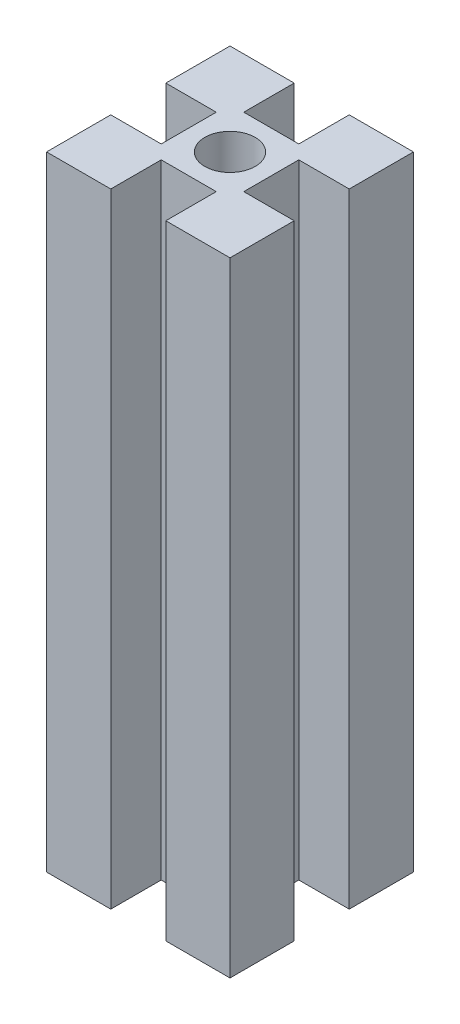
from build123d import *

# Parameters (mm, degrees)
SKETCH1_W    = 20
SKETCH1_H    = 20
BODY_DEPTH   = 68
SKETCH2_R    = 2.75
SKETCH2_W    = 6
SKETCH2_H    = 5.5
SKETCH2_W_2  = 5.5
SKETCH2_H_2  = 6
PROFIL_DEPTH = 70.455021417


with BuildPart() as part:
    # Sketch1 → Body (new body)
    with BuildSketch(Plane(origin=(0, 0, 0), x_dir=(1, 0, 0), z_dir=(0, 1, 0))):
        Rectangle(SKETCH1_W, SKETCH1_H)
    extrude(amount=BODY_DEPTH)

    # Sketch2 → Profil (cut, through all)
    with BuildSketch(Plane(origin=(0, 68, 0), x_dir=(1, 0, 0), z_dir=(0, 1, 0))):
        with Locations(Location((0, 0, 0), (0, 0, 270))):
            Circle(SKETCH2_R)
        with Locations((0, 7.25)):
            Rectangle(SKETCH2_W, SKETCH2_H)
        with Locations((7.25, 0)):
            Rectangle(SKETCH2_W_2, SKETCH2_H_2)
        with Locations((0, -7.25)):
            Rectangle(SKETCH2_W, SKETCH2_H)
        with Locations((-7.25, 0)):
            Rectangle(SKETCH2_W_2, SKETCH2_H_2)
    extrude(amount=-PROFIL_DEPTH, mode=Mode.SUBTRACT)


solid = part.part
